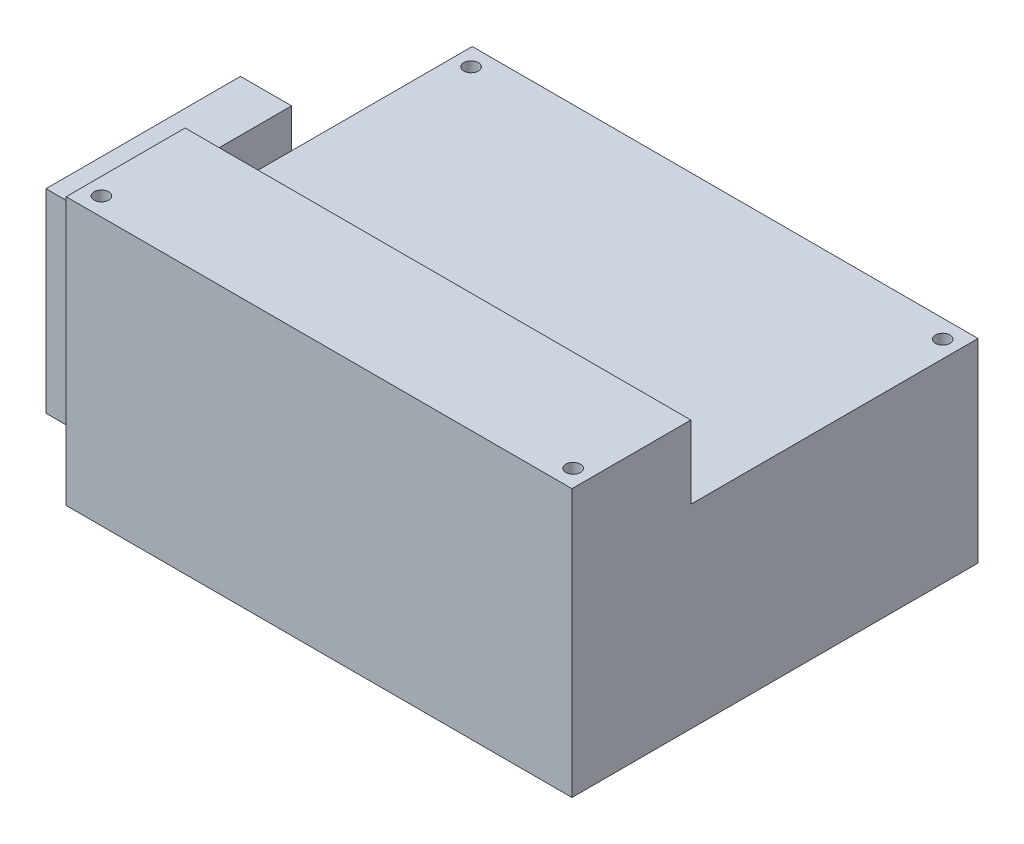
from build123d import *

# Parameters (mm, degrees)
SKETCH1_W           = 104
SKETCH1_H           = 83.5
BOSS_EXTRUDE1_DEPTH = 55
SKETCH2_W           = 59.042208754
SKETCH2_H           = 15
CUT_EXTRUDE1_DEPTH  = 145.267979815
SKETCH3_R           = 1.5
CUT_EXTRUDE2_DEPTH  = 145.267979815
SKETCH4_W           = 40
SKETCH4_H           = 40
BOSS_EXTRUDE2_DEPTH = 10.5


with BuildPart() as part:
    # Sketch1 → Boss-Extrude1 (new body)
    with BuildSketch(Plane(origin=(0, 0, 0), x_dir=(1, 0, 0), z_dir=(0, 1, 0))):
        with Locations((52, 41.75)):
            Rectangle(SKETCH1_W, SKETCH1_H)
    extrude(amount=BOSS_EXTRUDE1_DEPTH)

    # Sketch2 → Cut-Extrude1 (cut, through all)
    with BuildSketch(Plane(origin=(104, 0, 0), x_dir=(0, 0, -1), z_dir=(1, 0, 0))):
        with Locations((53.978895623, 47.5)):
            Rectangle(SKETCH2_W, SKETCH2_H)
    extrude(amount=-CUT_EXTRUDE1_DEPTH, mode=Mode.SUBTRACT)

    # Sketch3 → Cut-Extrude2 (cut, through all)
    with BuildSketch(Plane.XZ):
        with Locations(Location((3.5, -79.75, 0), (0, 0, 270))):
            Circle(SKETCH3_R)
        with Locations(Location((3.5, -3.75, 0), (0, 0, 270))):
            Circle(SKETCH3_R)
        with Locations(Location((100.5, -3.75, 0), (0, 0, 270))):
            Circle(SKETCH3_R)
        with Locations(Location((100.5, -79.75, 0), (0, 0, 270))):
            Circle(SKETCH3_R)
    extrude(amount=-CUT_EXTRUDE2_DEPTH, mode=Mode.SUBTRACT)

    # Sketch4 → Boss-Extrude2 (add)
    with BuildSketch(Plane.ZY):
        with Locations((-26.35, 28)):
            Rectangle(SKETCH4_W, SKETCH4_H)
    extrude(amount=BOSS_EXTRUDE2_DEPTH)


solid = part.part
